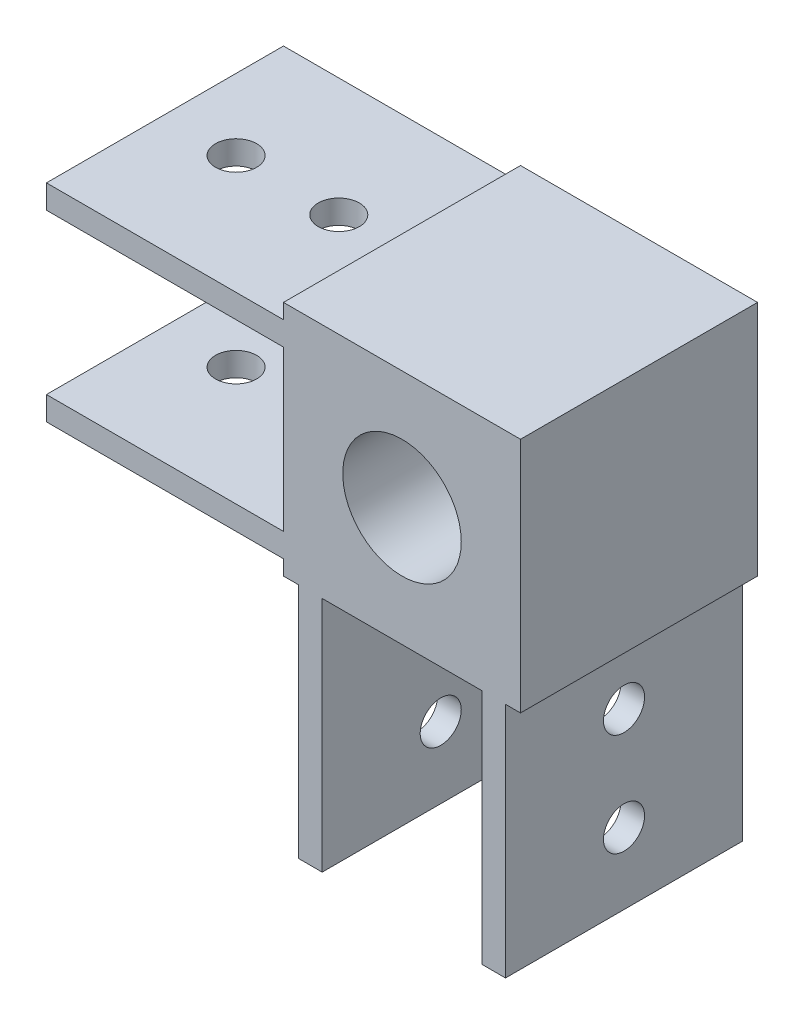
from build123d import *

# Parameters (mm, degrees)
EXTRUDE_1_DEPTH     = 30
SKETCH_2_R          = 7.5
CUT_EXTRUDE_1_DEPTH = 71.356236397
SKETCH_5_R          = 2.6
CUT_EXTRUDE_4_DEPTH = 80.376381878
SKETCH_6_R          = 2.6
CUT_EXTRUDE_5_DEPTH = 80.376381878


with BuildPart() as part:
    # 草图1 → 凸台-拉伸1 (new body)
    with BuildSketch(Plane.XY):
        Polygon((-15, -15), (-13.1, -15), (-13.1, -45), (-10.1, -45), (-10.1, -15), (10.1, -15), (10.1, -45), (13.1, -45), (13.1, -15), (15, -15), (15, 15), (-15, 15), (-15, 13.1), (-45, 13.1), (-45, 10.1), (-15, 10.1), (-15, -10.1), (-45, -10.1), (-45, -13.1), (-15, -13.1), align=None)
    extrude(amount=EXTRUDE_1_DEPTH)

    # 草图2 → 切除-拉伸1 (cut, through all)
    with BuildSketch(Plane.XY.offset(30)):
        Circle(SKETCH_2_R)
    extrude(amount=-CUT_EXTRUDE_1_DEPTH, mode=Mode.SUBTRACT)

    # 草图5 → 切除-拉伸4 (cut, through all)
    with BuildSketch(Plane(origin=(13.1, 0, 0), x_dir=(0, 0, -1), z_dir=(1, 0, 0))):
        with Locations(Location((-15, -23, 0), (0, 0, 90))):
            Circle(SKETCH_5_R)
        with Locations(Location((-15, -36, 0), (0, 0, 90))):
            Circle(SKETCH_5_R)
    extrude(amount=-CUT_EXTRUDE_4_DEPTH, mode=Mode.SUBTRACT)

    # 草图6 → 切除-拉伸5 (cut, through all)
    with BuildSketch(Plane(origin=(0, 13.1, 0), x_dir=(1, 0, 0), z_dir=(0, 1, 0))):
        with Locations(Location((-23, -15, 0), (0, 0, 180))):
            Circle(SKETCH_6_R)
        with Locations(Location((-36, -15, 0), (0, 0, 180))):
            Circle(SKETCH_6_R)
    extrude(amount=-CUT_EXTRUDE_5_DEPTH, mode=Mode.SUBTRACT)


solid = part.part
